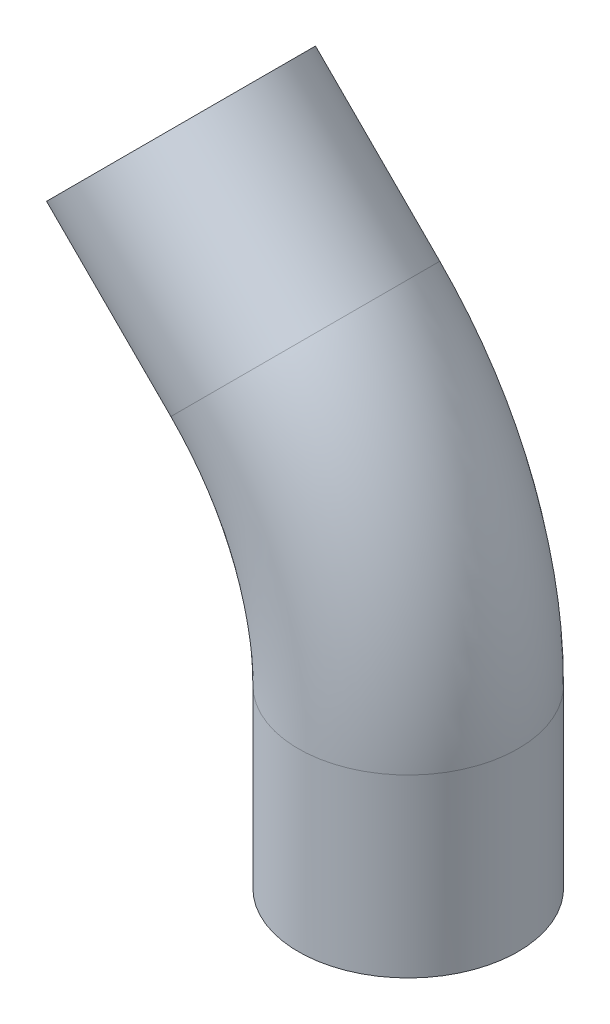
from build123d import *

# Parameters (mm, degrees)
SKETCH2_R = 25
SHELL1_T  = -5


with BuildPart() as part:
    # Sweep1: sweep along a path in Sketch1
    with BuildLine(Plane.XY) as sweep1_path:
        Line((-51.715728753, 84.852813742), (-23.431457505, 56.568542495))
        ThreePointArc((-23.431457505, 56.568542495), (-6.089637399, 30.614674589), (0, 0))
        Line((0, 0), (0, -40))
    # Sketch2 → Sweep1 (sweep)
    with BuildSketch(Plane(origin=(0, -40, 0), x_dir=(-1, 0, 0), z_dir=(0, -1, 0))):
        Circle(SKETCH2_R)
    sweep(path=sweep1_path.line)

    # Shell1
    shell1_openings = [part.faces().sort_by_distance(p)[0] for p in [
        (0, -40, 0),
        (-51.715728753, 84.852813742, 0),
    ]]
    offset(amount=SHELL1_T, openings=shell1_openings, kind=Kind.INTERSECTION)


solid = part.part
